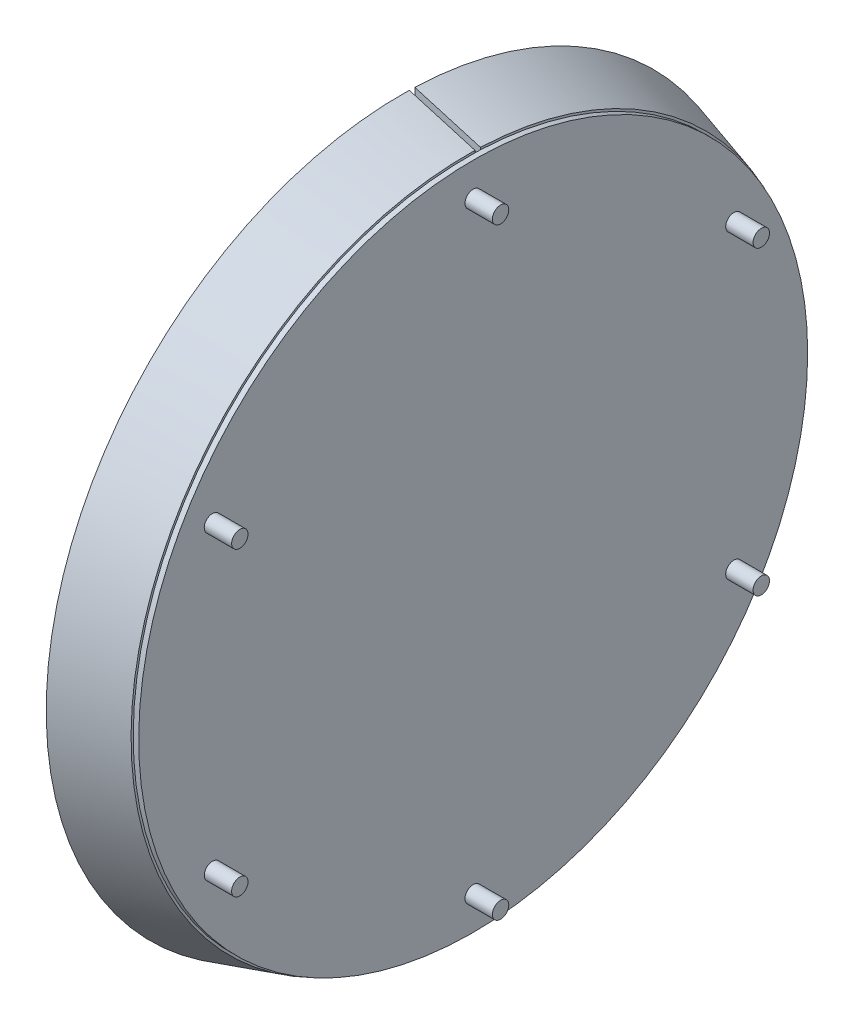
from build123d import *

# Parameters (mm, degrees)
CUT_EXTRUDE1_REACH  = 94.704
SKETCH3_W           = 1
SKETCH3_H           = 9
SKETCH7_R           = 61.102685311
BOSS_EXTRUDE1_DEPTH = 1
SKETCH8_R           = 1.5
BOSS_EXTRUDE2_DEPTH = 5
CIRPATTERN1_COUNT   = 6


with BuildPart() as part:
    # Sketch2 → Revolve1 (revolve)
    with BuildSketch(Plane.XY, mode=Mode.PRIVATE) as revolve1_sk:
        Polygon((0, 65), (0, 63.5), (12, 60), (12, 61.5), align=None)
    revolve(revolve1_sk.sketch.rotate(Axis((0, 0, 0), (1, 0, 0)), 90), axis=Axis((0, 0, 0), (1, 0, 0)))

    # Cut-Extrude1: up to this face of the body (flat: up to its plane)
    cut_extrude1_end = Plane(part.part.faces().sort_by_distance((0, 0, -64.816152237))[0])
    # Sketch3 → Cut-Extrude1 (cut, up to the picked face)
    with BuildSketch(Plane(origin=(12, 0, 0), x_dir=(0, 0, -1), z_dir=(1, 0, 0)), mode=Mode.PRIVATE) as cut_extrude1_sk1:
        with Locations((1.827954501, 64.835601496)):
            Rectangle(SKETCH3_W, SKETCH3_H)
    cut_extrude1_tool1 = split(extrude(cut_extrude1_sk1.sketch, amount=-CUT_EXTRUDE1_REACH, mode=Mode.PRIVATE), bisect_by=cut_extrude1_end, keep=Keep.BOTH, mode=Mode.PRIVATE)
    add(cut_extrude1_tool1.solids().sort_by(Axis((12, 64.835601, -1.827955), (-1, 0, 0)))[0], mode=Mode.SUBTRACT)

    # Sketch7 → Boss-Extrude1 (add)
    with BuildSketch(Plane(origin=(12, 0, 0), x_dir=(0, 0, -1), z_dir=(1, 0, 0))):
        with Locations(Location((0, 0, 0), (0, 0, 88.754683549))):
            Circle(SKETCH7_R)
    extrude(amount=BOSS_EXTRUDE1_DEPTH)

    # Sketch8 → Boss-Extrude2 (add)
    with BuildSketch(Plane(origin=(13, 0, 0), x_dir=(0, 0, -1), z_dir=(1, 0, 0))):
        with Locations((0, 55)):
            Circle(SKETCH8_R)
    boss_extrude2 = extrude(amount=BOSS_EXTRUDE2_DEPTH)

    # CirPattern1: Boss-Extrude2 ×6 about axis
    cirpattern1_axis = Axis((0, 0, 0), (1, 0, 0))
    for i in range(1, CIRPATTERN1_COUNT):
        add(boss_extrude2.rotate(cirpattern1_axis, i * 360 / CIRPATTERN1_COUNT))


solid = part.part
